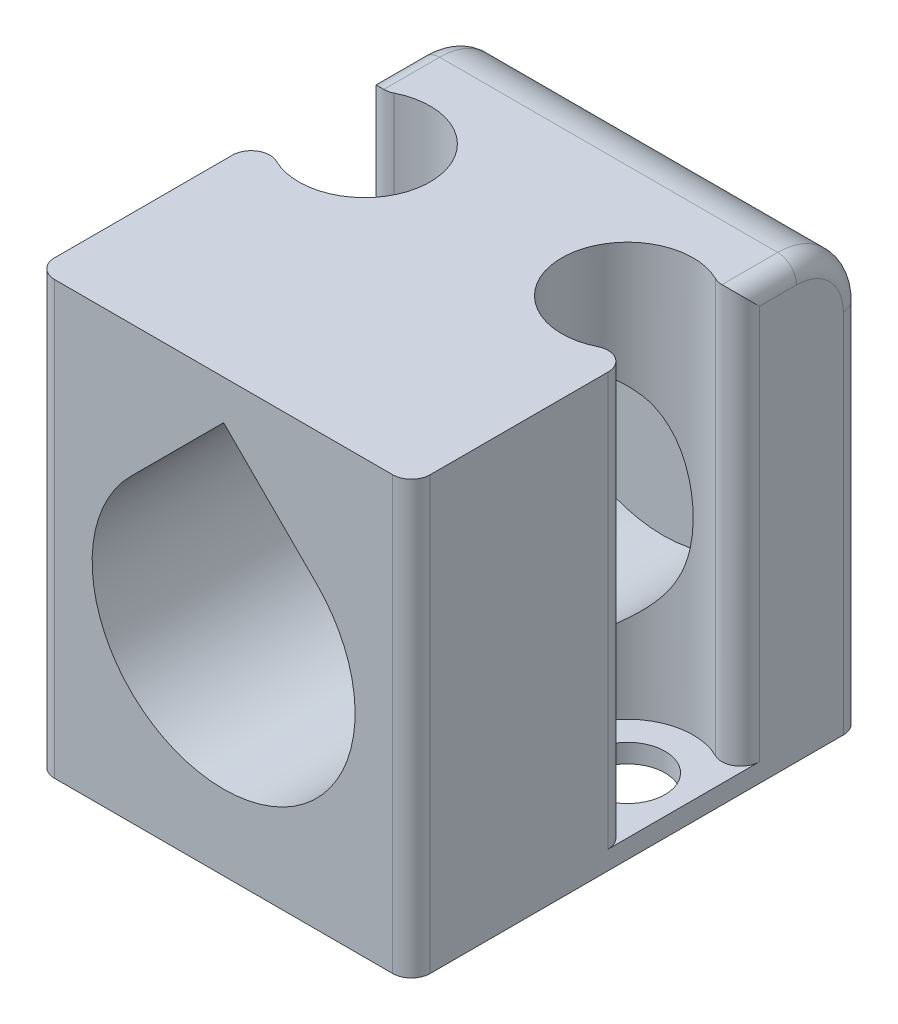
from build123d import *

# Parameters (mm, degrees)
SKETCH1_W           = 20
SKETCH1_H           = 24
SKETCH1_R           = 2
BOSS_EXTRUDE2_DEPTH = 1
BOSS_EXTRUDE3_DEPTH = 23
SKETCH1_5_R         = 2
BOSS_EXTRUDE4_DEPTH = 5
CUT_EXTRUDE1_DEPTH  = 23.5
FILLET2_R           = 3.5
FILLET1_R           = 1
CUT_EXTRUDE3_START  = -19.5
CUT_EXTRUDE3_DEPTH  = 18.5


with BuildPart() as part:
    # Sketch1 → Boss-Extrude2 (new body)
    with BuildSketch(Plane(origin=(0, 0, 0), x_dir=(1, 0, 0), z_dir=(0, 1, 0))):
        with Locations((0, -4.5)):
            Rectangle(SKETCH1_W, SKETCH1_H)
        with Locations(Location((-7, -2, 0), (0, 0, 270))):
            Circle(SKETCH1_R, mode=Mode.SUBTRACT)
        with Locations(Location((7, -2, 0), (0, 0, 270))):
            Circle(SKETCH1_R, mode=Mode.SUBTRACT)
    extrude(amount=BOSS_EXTRUDE2_DEPTH)

    # Sketch1<4> → Boss-Extrude3 (add)
    with BuildSketch(Plane(origin=(0, 0, 0), x_dir=(1, 0, 0), z_dir=(0, 1, 0))):
        with BuildLine():
            Line((10, 7.5), (-10, 7.5))
            Line((-10, 7.5), (-10, -0.197224362))
            ThreePointArc((-10, -0.197224362), (-6.064585653, 1.372684391), (-3.5, -2))
            ThreePointArc((-3.5, -2), (-6.064585653, -5.372684391), (-10, -3.802775638))
            Line((-10, -3.802775638), (-10, -16.5))
            Line((-10, -16.5), (10, -16.5))
            Line((10, -16.5), (10, -3.802775638))
            ThreePointArc((10, -3.802775638), (3.5, -2), (10, -0.197224362))
            Line((10, -0.197224362), (10, 7.5))
        make_face()
    extrude(amount=BOSS_EXTRUDE3_DEPTH)

    # Sketch2 → Cut-Extrude1 (cut)
    with BuildSketch(Plane.XY.offset(16.5)):
        with BuildLine():
            Line((-4.949747468, 15.949747468), (0, 20.899494937))
            Line((0, 20.899494937), (4.949747468, 15.949747468))
            ThreePointArc((4.949747468, 15.949747468), (0, 4), (-4.949747468, 15.949747468))
        make_face()
    extrude(amount=-CUT_EXTRUDE1_DEPTH, mode=Mode.SUBTRACT)

    # Fillet2
    fillet2_edges = [part.edges().sort_by_distance(p)[0] for p in [
        (0, 23, -7.5),
    ]]
    fillet(fillet2_edges, radius=FILLET2_R)

    # Fillet1
    fillet1_edges = [part.edges().sort_by_distance(p)[0] for p in [
        (10, 12, 3.802775638),
        (10, 12, 0.197224362),
        (-10, 12, 3.802775638),
        (-10, 12, 0.197224362),
        (-10, 11.5, 16.5),
        (10, 11.5, 16.5),
        (10, 9.75, -7.5),
        (-10, 9.75, -7.5),
        (10, 23, -1.901387819),
        (10, 21.974873734, -6.474873734),
        (-10, 23, -1.901387819),
        (-10, 21.974873734, -6.474873734),
    ]]
    fillet(fillet1_edges, radius=FILLET1_R)

    # Sketch4 → Cut-Extrude3 (cut)
    with BuildSketch(Plane.XZ.offset(CUT_EXTRUDE3_START)):
        with BuildLine():
            Line((-9.5, -2.251571667), (-9.5, -6))
            ThreePointArc((-9.5, -6), (-9.207106781, -6.707106781), (-8.5, -7))
            Line((-8.5, -7), (8.5, -7))
            ThreePointArc((8.5, -7), (9.207106781, -6.707106781), (9.5, -6))
            Line((9.5, -6), (9.5, -2))
            Line((9.5, -2), (9.4, -2))
            Line((9.4, -2), (9.4, -6))
            ThreePointArc((9.4, -6), (9.136396103, -6.636396103), (8.5, -6.9))
            Line((8.5, -6.9), (-8.5, -6.9))
            ThreePointArc((-8.5, -6.9), (-9.136396103, -6.636396103), (-9.4, -6))
            Line((-9.4, -6), (-9.4, -2.251571667))
            Line((-9.4, -2.251571667), (-9.5, -2.251571667))
        make_face()
    extrude(amount=CUT_EXTRUDE3_DEPTH, mode=Mode.SUBTRACT)


with BuildPart() as body_2:
    # Sketch1<5> → Boss-Extrude4 (new body)
    # profile 1 of 2: a face of its own
    with BuildSketch(Plane(origin=(0, 0, 0), x_dir=(1, 0, 0), z_dir=(0, 1, 0))):
        with BuildLine():
            ThreePointArc((-3.5, -2), (-6.064585653, 1.372684391), (-10, -0.197224362))
            Line((-10, -0.197224362), (-10, -3.802775638))
            ThreePointArc((-10, -3.802775638), (-6.064585653, -5.372684391), (-3.5, -2))
        make_face()
        with Locations(Location((-7, -2, 0), (0, 0, 270))):
            Circle(SKETCH1_5_R, mode=Mode.SUBTRACT)
    # profile 2 of 2: a face of its own
    with BuildSketch(Plane(origin=(0, 0, 0), x_dir=(1, 0, 0), z_dir=(0, 1, 0))):
        with Locations(Location((-7, -2, 0), (0, 0, 270))):
            Circle(SKETCH1_5_R)
    extrude(amount=BOSS_EXTRUDE4_DEPTH)


solid = part.part
